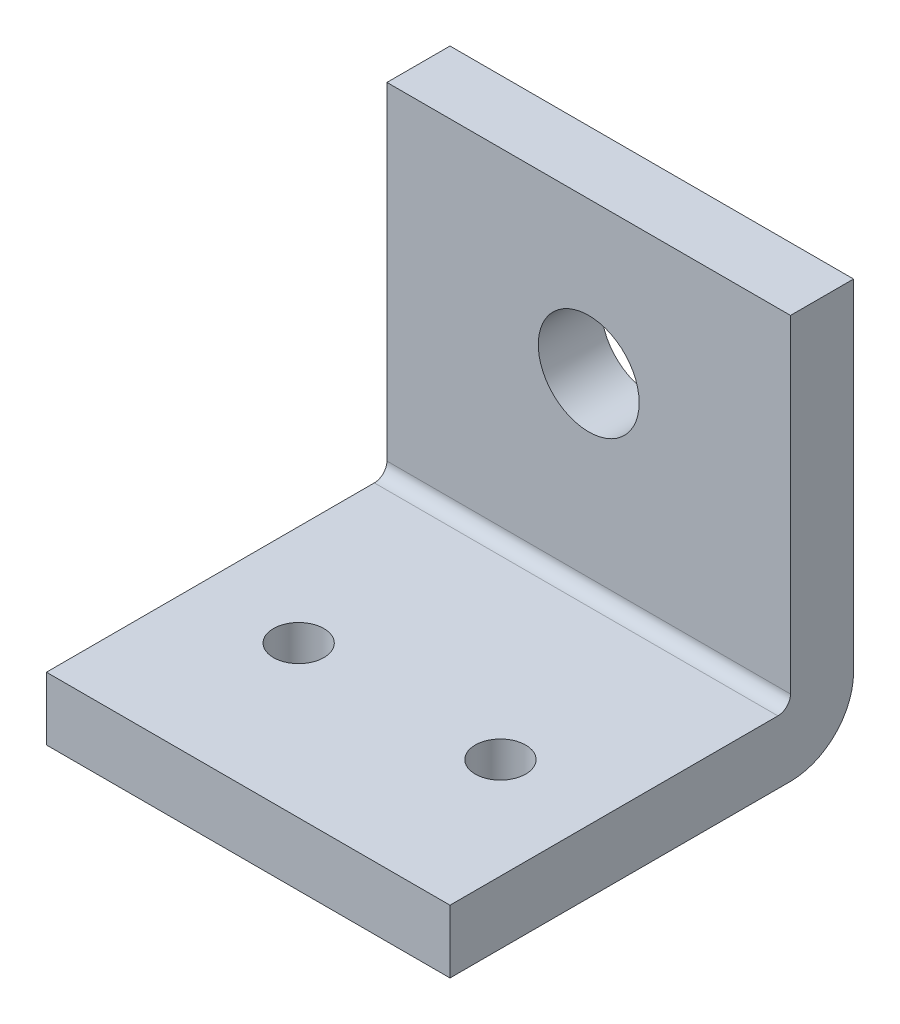
from build123d import *

# Parameters (mm, degrees)
SKETCH1_W           = 40
SKETCH1_H           = 33.75
SKETCH1_R           = 2.5
BOSS_EXTRUDE1_DEPTH = 6.25
SKETCH1_3_W         = 40
SKETCH1_3_H         = 6.25
BOSS_EXTRUDE2_DEPTH = 40
FILLET1_R           = 6.25
FILLET2_R           = 1.25
SKETCH2_R           = 5
CUT_EXTRUDE1_DEPTH  = 40


with BuildPart() as part:
    # Sketch1 → Boss-Extrude1 (new body)
    with BuildSketch(Plane(origin=(0, 0, 0), x_dir=(1, 0, 0), z_dir=(0, 1, 0))):
        with Locations((20, 16.875)):
            Rectangle(SKETCH1_W, SKETCH1_H)
        with Locations((10, 15)):
            Circle(SKETCH1_R, mode=Mode.SUBTRACT)
        with Locations((30, 15)):
            Circle(SKETCH1_R, mode=Mode.SUBTRACT)
    extrude(amount=BOSS_EXTRUDE1_DEPTH)

    # Sketch1<3> → Boss-Extrude2 (add)
    with BuildSketch(Plane(origin=(0, 0, 0), x_dir=(1, 0, 0), z_dir=(0, 1, 0))):
        with Locations((20, 36.875)):
            Rectangle(SKETCH1_3_W, SKETCH1_3_H)
    extrude(amount=BOSS_EXTRUDE2_DEPTH)

    # Fillet1
    fillet1_edges = [part.edges().sort_by_distance(p)[0] for p in [
        (20, 0, -40),
    ]]
    fillet(fillet1_edges, radius=FILLET1_R)

    # Fillet2
    fillet2_edges = [part.edges().sort_by_distance(p)[0] for p in [
        (20, 6.25, -33.75),
    ]]
    fillet(fillet2_edges, radius=FILLET2_R)

    # Sketch2 → Cut-Extrude1 (cut)
    with BuildSketch(Plane.XY.offset(-33.75)):
        with Locations((20, 25)):
            Circle(SKETCH2_R)
    extrude(amount=-CUT_EXTRUDE1_DEPTH, mode=Mode.SUBTRACT)


solid = part.part
